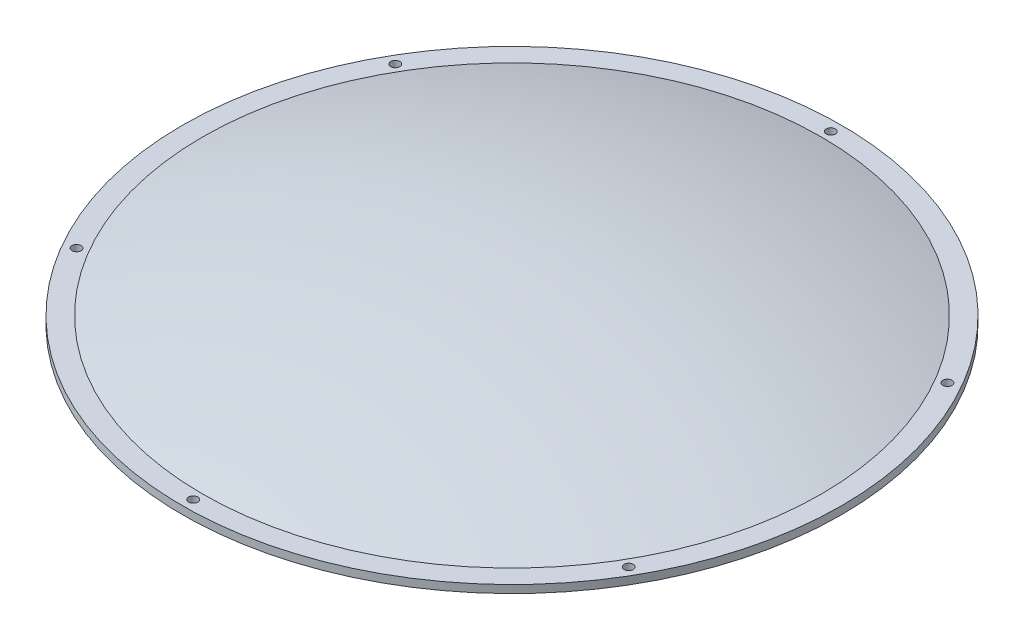
from build123d import *

# Parameters (mm, degrees)
SKETCH4_R          = 1.4732
CUT_EXTRUDE1_DEPTH = 153.597454552


with BuildPart() as part:
    # Sketch1 → Revolve1 (revolve)
    with BuildSketch(Plane.XY):
        with BuildLine():
            ThreePointArc((100.434849632, 285.382712475), (50.944900471, 298.219832868), (0, 302.54))
            Line((0, 302.54), (0, 300))
            ThreePointArc((0, 300), (50.730593618, 295.679567896), (100, 282.842712475))
            Line((100, 282.842712475), (107, 282.842712475))
            Line((107, 282.842712475), (107, 285.382712475))
            Line((107, 285.382712475), (100.434849632, 285.382712475))
        make_face()
    revolve(axis=Axis((0, 282.842712475, 0), (0, -1, 0)))

    # Sketch4 → Cut-Extrude1 (cut, through all)
    with BuildSketch(Plane.XZ.offset(-282.842712475)):
        with Locations((0, 103.5)):
            Circle(SKETCH4_R)
        with Locations((89.633629292, 51.75)):
            Circle(SKETCH4_R)
        with Locations((89.633629292, -51.75)):
            Circle(SKETCH4_R)
        with Locations((0, -103.5)):
            Circle(SKETCH4_R)
        with Locations((-89.633629292, -51.75)):
            Circle(SKETCH4_R)
        with Locations((-89.633629292, 51.75)):
            Circle(SKETCH4_R)
    extrude(amount=-CUT_EXTRUDE1_DEPTH, mode=Mode.SUBTRACT)


solid = part.part
